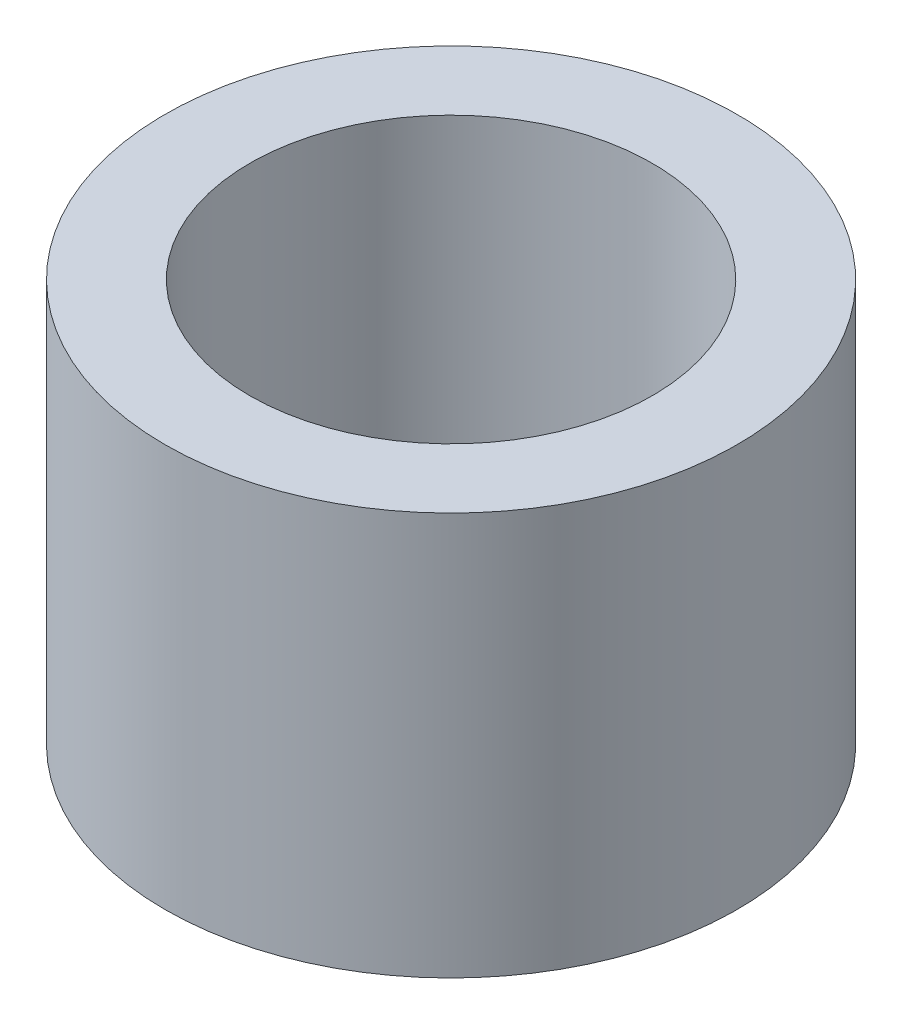
from build123d import *

# Parameters (mm, degrees)
SKETCH_1_R      = 13.5
SKETCH_1_R_2    = 9.5
EXTRUDE_1_DEPTH = 19


with BuildPart() as part:
    # Эскиз1 → Бобышка-Вытянуть1 (new body)
    with BuildSketch(Plane(origin=(0, 0, 0), x_dir=(1, 0, 0), z_dir=(0, 1, 0))):
        with Locations(Location((0, 0, 0), (0, 0, 270))):
            Circle(SKETCH_1_R)
        with Locations(Location((0, 0, 0), (0, 0, 270))):
            Circle(SKETCH_1_R_2, mode=Mode.SUBTRACT)
    extrude(amount=EXTRUDE_1_DEPTH)


solid = part.part
